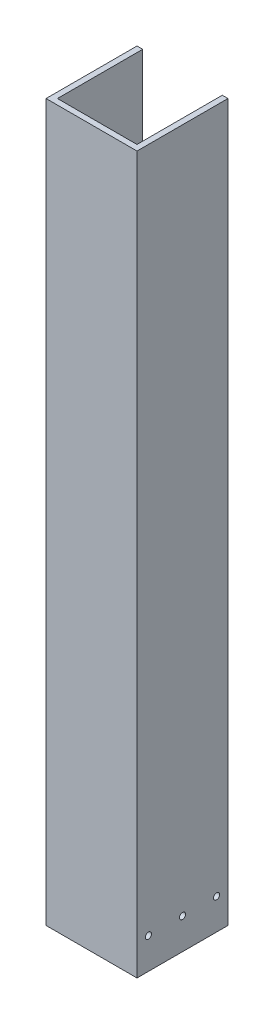
from build123d import *

# Parameters (mm, degrees)
BOSS_EXTRUDE1_DEPTH       = 400
TAP_DRILL_FOR_8_32_TAP1_D = 3.4544


with BuildPart() as part:
    # Sketch1 → Boss-Extrude1 (new body)
    with BuildSketch(Plane(origin=(0, 0, 0), x_dir=(1, 0, 0), z_dir=(0, 1, 0))):
        Polygon((0, 0), (0, -50.8), (50.8, -50.8), (50.8, 0), (47.625, 0), (47.625, -47.625), (3.175, -47.625), (3.175, 0), align=None)
    extrude(amount=BOSS_EXTRUDE1_DEPTH)

    # Tap Drill for #8-32 Tap1 (through all)
    with Locations(Plane(origin=(50.8, 0, 0), x_dir=(0, 0, -1), z_dir=(1, 0, 0))):
        with Locations((-44.45, 17.3), (-25.4, 17.3), (-6.35, 17.3)):
            Hole(TAP_DRILL_FOR_8_32_TAP1_D / 2)


solid = part.part
